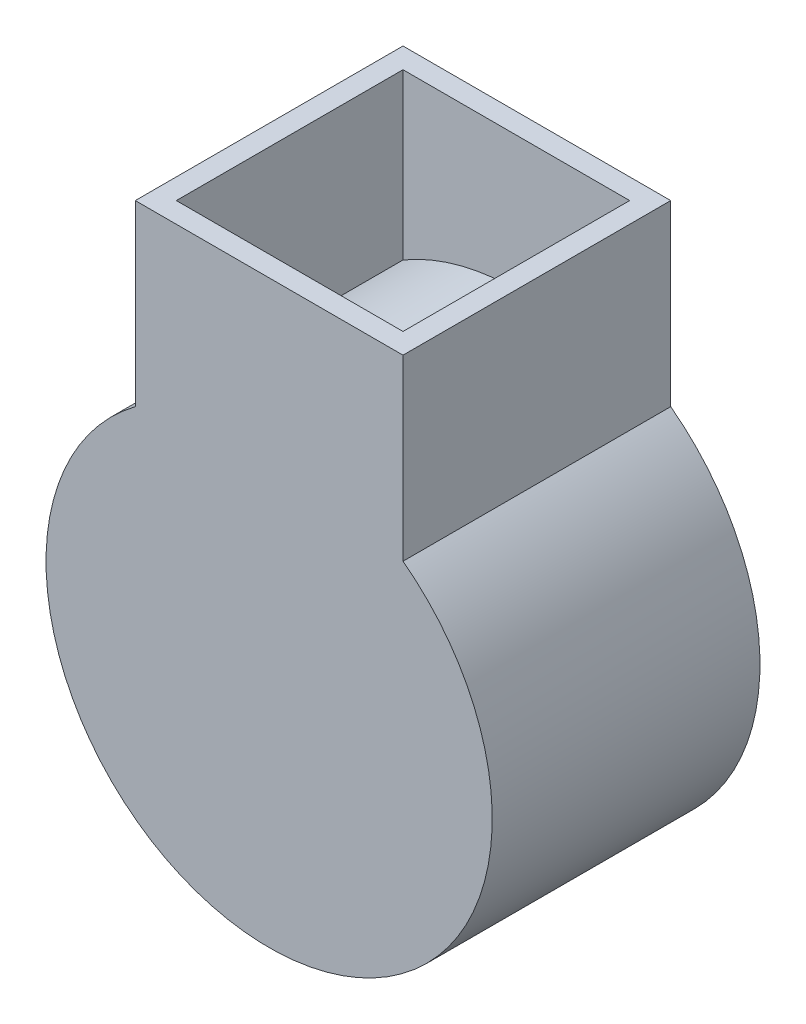
from build123d import *

# Parameters (mm, degrees)
CROQUIS1_R                   = 50
SALIENTE_EXTRUIR1_DEPTH      = 30
CROQUIS2_R                   = 45
CROQUIS2_R_2                 = 32.5
CORTAR_EXTRUIR1_DEPTH        = 2
CROQUIS3_R                   = 13
CORTAR_EXTRUIR2_DEPTH        = 6
SALIENTE_EXTRUIR2_REACH      = 144.478
SALIENTE_EXTRUIR2_END_RADIUS = 50
CROQUIS5_W                   = 60
CROQUIS5_H                   = 60
CROQUIS5_W_2                 = 50.8
CROQUIS5_H_2                 = 50.8


with BuildPart() as part:
    # Croquis1 → Saliente-Extruir1 (new, symmetric)
    with BuildSketch(Plane.XY):
        Circle(CROQUIS1_R)
    extrude(amount=SALIENTE_EXTRUIR1_DEPTH, both=True)

    # Croquis2 → Cortar-Extruir1 (cut)
    with BuildSketch(Plane(origin=(0, 0, -30), x_dir=(-1, 0, 0), z_dir=(0, 0, -1))):
        Circle(CROQUIS2_R)
        Circle(CROQUIS2_R_2, mode=Mode.SUBTRACT)
    extrude(amount=-CORTAR_EXTRUIR1_DEPTH, mode=Mode.SUBTRACT)

    # Croquis3 → Cortar-Extruir2 (cut)
    with BuildSketch(Plane(origin=(0, 0, -30), x_dir=(-1, 0, 0), z_dir=(0, 0, -1))):
        Circle(CROQUIS3_R)
    extrude(amount=-CORTAR_EXTRUIR2_DEPTH, mode=Mode.SUBTRACT)

    # Saliente-Extruir2: up to this cylinder (the profile starts outside it)
    saliente_extruir2_end = Plane(origin=(0, 0, 29.151472), z_dir=(0, 0, -1)) * Cylinder(SALIENTE_EXTRUIR2_END_RADIUS, 389.956, mode=Mode.PRIVATE)
    # Croquis5 → Saliente-Extruir2 (add, up to the surface)
    with BuildSketch(Plane(origin=(0, 80, 0), x_dir=(1, 0, 0), z_dir=(0, 1, 0)), mode=Mode.PRIVATE) as saliente_extruir2_sk1:
        Rectangle(CROQUIS5_W, CROQUIS5_H)
        Rectangle(CROQUIS5_W_2, CROQUIS5_H_2, mode=Mode.SUBTRACT)
    saliente_extruir2_tool1 = extrude(saliente_extruir2_sk1.sketch, amount=-SALIENTE_EXTRUIR2_REACH, mode=Mode.PRIVATE) - saliente_extruir2_end
    add(saliente_extruir2_tool1.solids().sort_by_distance((0, 80, 29.151472))[0])


solid = part.part
